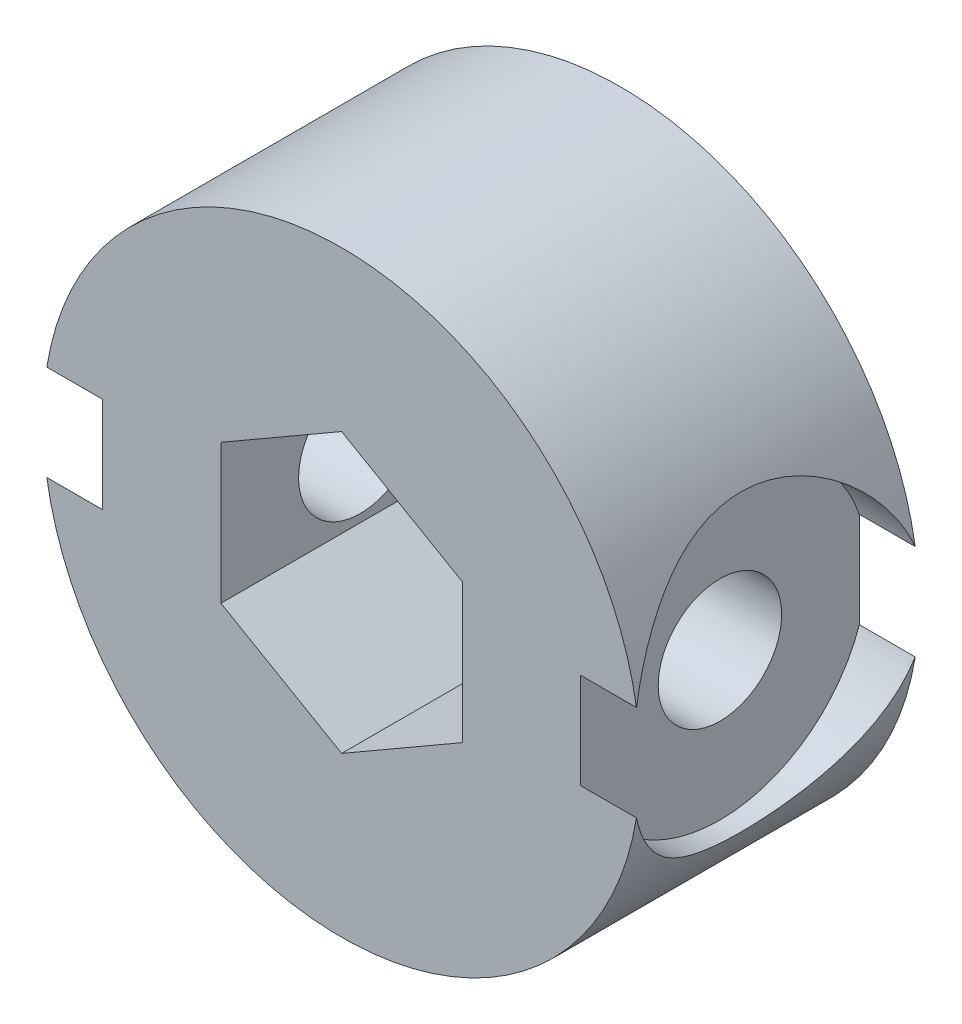
from build123d import *

# Parameters (mm, degrees)
SKETCH1_R               = 7.5
BOSS_EXTRUDE2_DEPTH     = 7
CUT_EXTRUDE1_DEPTH      = 7.5
CUT_EXTRUDE1_DEPTH_BACK = 7.5
SKETCH2_R               = 1.55
SKETCH4_R               = 3.7
CUT_EXTRUDE2_DEPTH      = 4
CUT_EXTRUDE3_START      = -4
SKETCH5_R               = 3.7
CUT_EXTRUDE3_DEPTH      = 4


with BuildPart() as part:
    # Sketch1 → Boss-Extrude2 (new body)
    with BuildSketch(Plane.XY):
        Circle(SKETCH1_R)
        Polygon((-3.031088913, 1.75), (0, 3.5), (3.031088913, 1.75), (3.031088913, -1.75), (0, -3.5), (-3.031088913, -1.75), align=None, mode=Mode.SUBTRACT)
    extrude(amount=BOSS_EXTRUDE2_DEPTH)

    # Sketch2 → Cut-Extrude1 (cut, two sides: drawn at the far end of the back side and taken through both)
    with BuildSketch(Plane.ZY.offset(-CUT_EXTRUDE1_DEPTH_BACK)):
        with Locations(Location((3.5, 0, 0), (0, 0, 180))):
            Circle(SKETCH2_R)
    extrude(amount=CUT_EXTRUDE1_DEPTH + CUT_EXTRUDE1_DEPTH_BACK, mode=Mode.SUBTRACT)

    # Sketch4 → Cut-Extrude2 (cut)
    with BuildSketch(Plane.ZY.offset(6)):
        with Locations((3.5, 0)):
            Circle(SKETCH4_R)
    extrude(amount=CUT_EXTRUDE2_DEPTH, mode=Mode.SUBTRACT)

    # Sketch5 → Cut-Extrude3 (cut)
    with BuildSketch(Plane.ZY.offset(-6).offset(CUT_EXTRUDE3_START)):
        with Locations((3.5, 0)):
            Circle(SKETCH5_R)
    extrude(amount=CUT_EXTRUDE3_DEPTH, mode=Mode.SUBTRACT)


solid = part.part
